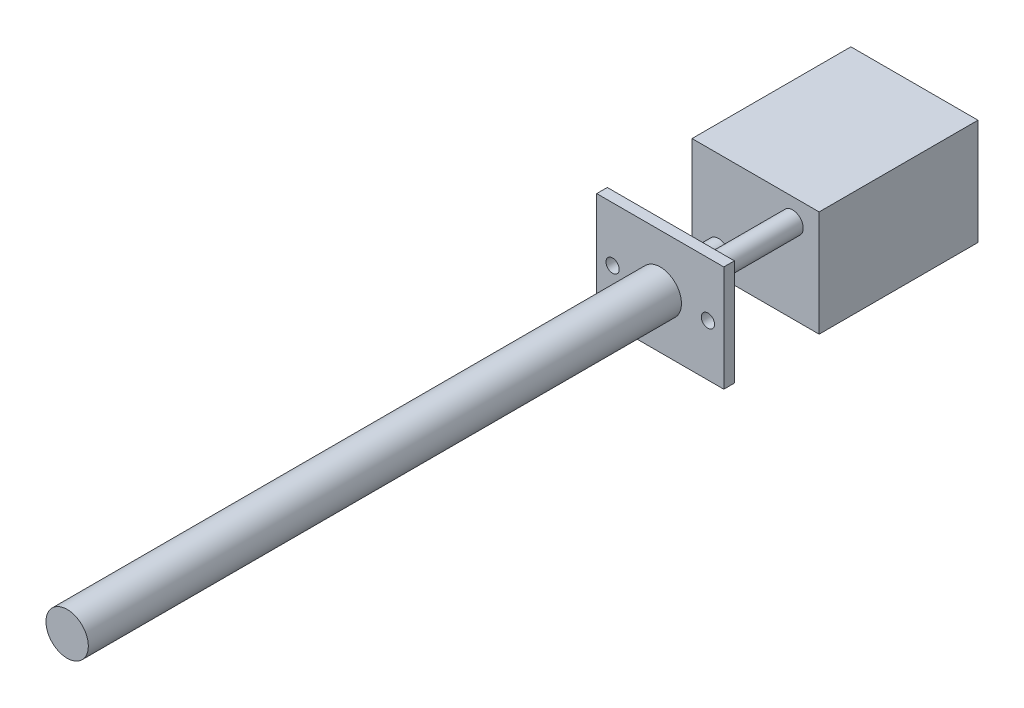
from build123d import *

# Parameters (mm, degrees)
SKETCH2_W               = 12
SKETCH2_H               = 10
BOSS_EXTRUDE1_DEPTH     = 15
SKETCH3_W               = 12
SKETCH3_H               = 10
BOSS_EXTRUDE2_DEPTH     = 1
SKETCH4_R               = 2
BOSS_EXTRUDE3_DEPTH     = 56
BOSS_EXTRUDE4_REACH     = 59.533
SKETCH5_R               = 1
M1_6_TAPPED_HOLE1_D     = 1.25
M1_6_TAPPED_HOLE1_DEPTH = 4.25
M1_6_TAPPED_HOLE1_TIP   = 0.375537887


with BuildPart() as part:
    # Sketch2 → Boss-Extrude1 (new body)
    with BuildSketch(Plane.XY):
        Rectangle(SKETCH2_W, SKETCH2_H)
    extrude(amount=-BOSS_EXTRUDE1_DEPTH)

    # Sketch5 → Boss-Extrude4 (add, up to next)
    with BuildSketch(Plane(origin=(0, 0, 8), x_dir=(-1, 0, 0), z_dir=(0, 0, -1)), mode=Mode.PRIVATE) as boss_extrude4_sk1:
        with Locations((-3.5, 2.916666667)):
            Circle(SKETCH5_R)
    boss_extrude4_tool1 = extrude(boss_extrude4_sk1.sketch, amount=BOSS_EXTRUDE4_REACH, mode=Mode.PRIVATE) - part.part
    # Sketch5 → Boss-Extrude4 (add, up to next)
    with BuildSketch(Plane(origin=(0, 0, 8), x_dir=(-1, 0, 0), z_dir=(0, 0, -1)), mode=Mode.PRIVATE) as boss_extrude4_sk2:
        with Locations((3.5, -2.916666667)):
            Circle(SKETCH5_R)
    boss_extrude4_tool2 = extrude(boss_extrude4_sk2.sketch, amount=BOSS_EXTRUDE4_REACH, mode=Mode.PRIVATE) - part.part


with BuildPart() as body_2:
    # Sketch3 → Boss-Extrude2 (new body)
    with BuildSketch(Plane.XY.offset(9)):
        Rectangle(SKETCH3_W, SKETCH3_H)
    extrude(amount=-BOSS_EXTRUDE2_DEPTH)

    # Sketch4 → Boss-Extrude3 (add)
    with BuildSketch(Plane.XY.offset(9)):
        Circle(SKETCH4_R)
    extrude(amount=BOSS_EXTRUDE3_DEPTH)


with BuildPart() as part_1:
    add(part.part)

    add(body_2.part)  # Boss-Extrude4 merges body 2
    add(boss_extrude4_tool1.solids().sort_by_distance((3.5, 2.916667, 8))[0])
    add(boss_extrude4_tool2.solids().sort_by_distance((-3.5, -2.916667, 8))[0])

    # M1.6 Tapped Hole1
    with Locations(Plane.XY.offset(9)):
        with Locations((-4.5, -0.139522792), (4.5, -0.139522792)):
            Hole(M1_6_TAPPED_HOLE1_D / 2, depth=M1_6_TAPPED_HOLE1_DEPTH)
            with Locations((0, 0, -(M1_6_TAPPED_HOLE1_DEPTH + M1_6_TAPPED_HOLE1_TIP / 2))):  # 118° drill point
                Cone(0, M1_6_TAPPED_HOLE1_D / 2, M1_6_TAPPED_HOLE1_TIP, mode=Mode.SUBTRACT)


solid = part_1.part
